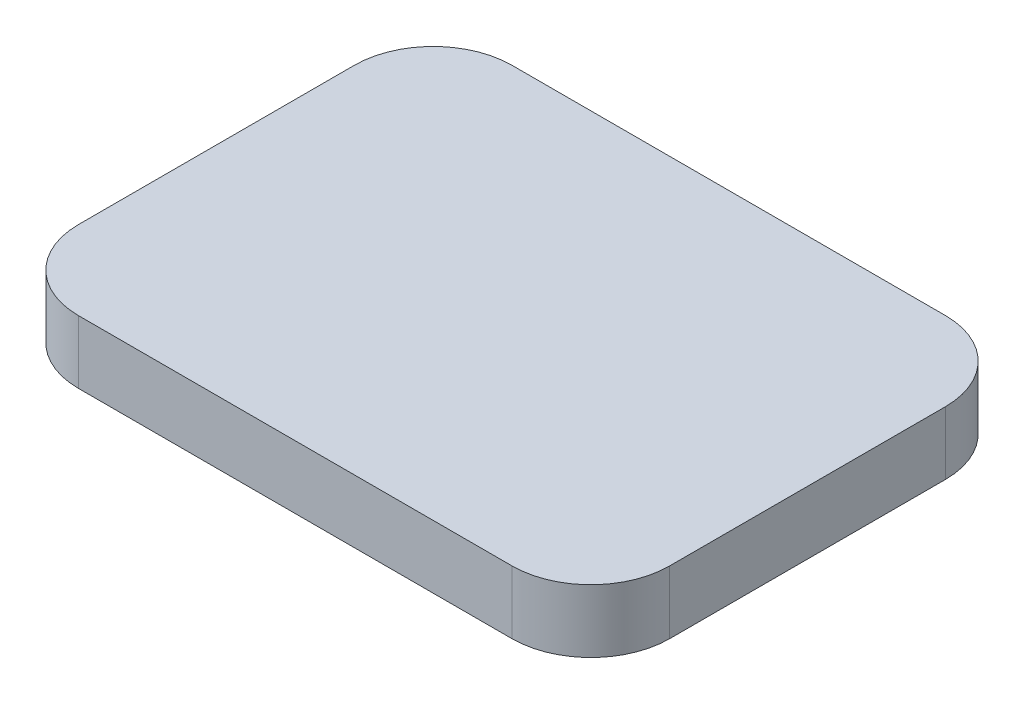
from build123d import *

# Parameters (mm, degrees)
SKETCH_1_W        = 15
SKETCH_1_H        = 11
EXTRUDE_255_DEPTH = 1.6
FILLET_1_R        = 2


with BuildPart() as part:
    # Эскиз1 → Extrude 255 (new body)
    with BuildSketch(Plane(origin=(0, 0, 0), x_dir=(1, 0, 0), z_dir=(0, 1, 0))):
        Rectangle(SKETCH_1_W, SKETCH_1_H)
    extrude(amount=EXTRUDE_255_DEPTH)

    # Скругление1
    fillet_1_edges = [part.edges().sort_by_distance(p)[0] for p in [
        (7.5, 0.8, 5.5),
        (-7.5, 0.8, 5.5),
        (-7.5, 0.8, -5.5),
        (7.5, 0.8, -5.5),
    ]]
    fillet(fillet_1_edges, radius=FILLET_1_R)


solid = part.part
